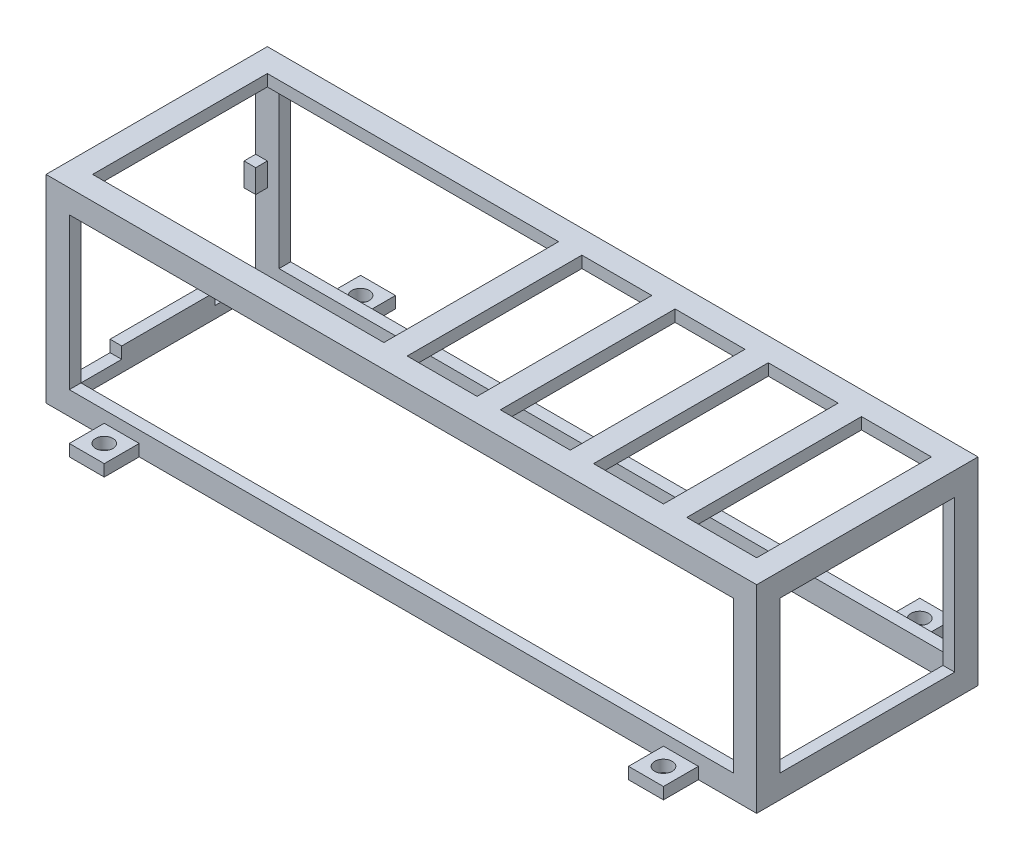
from build123d import *

# Parameters (mm, degrees)
SKETCH1_W           = 122
SKETCH1_H           = 38
SKETCH1_W_2         = 118
SKETCH1_H_2         = 34
BOSS_EXTRUDE1_DEPTH = 34
SKETCH2_W           = 34
SKETCH2_H           = 2
BOSS_EXTRUDE2_DEPTH = 120
CUT_EXTRUDE2_DEPTH  = 2
SKETCH4_W           = 114
SKETCH4_H           = 26
CUT_EXTRUDE4_DEPTH  = 2
SKETCH6_W           = 114
SKETCH6_H           = 26
CUT_EXTRUDE5_DEPTH  = 2
SKETCH7_W           = 30
SKETCH7_H           = 26
CUT_EXTRUDE6_DEPTH  = 2
SKETCH8_W           = 12
SKETCH8_H           = 30
CUT_EXTRUDE7_DEPTH  = 2
LPATTERN1_COUNT     = 4
LPATTERN1_PITCH     = 16
SKETCH9_W           = 50
SKETCH9_H           = 30
CUT_EXTRUDE8_DEPTH  = 2
SKETCH10_W          = 6
SKETCH10_H          = 2
BOSS_EXTRUDE5_DEPTH = 6
SKETCH11_W          = 6
SKETCH11_H          = 2
BOSS_EXTRUDE6_DEPTH = 6
SKETCH12_W          = 6
SKETCH12_H          = 2
BOSS_EXTRUDE7_DEPTH = 6
SKETCH13_W          = 6
SKETCH13_H          = 2
BOSS_EXTRUDE8_DEPTH = 6
SKETCH14_R          = 1.5
CUT_EXTRUDE9_DEPTH  = 2


with BuildPart() as part:
    # Sketch1 → Boss-Extrude1 (new body)
    with BuildSketch(Plane(origin=(0, 0, 0), x_dir=(1, 0, 0), z_dir=(0, 1, 0))):
        with Locations((61, 19)):
            Rectangle(SKETCH1_W, SKETCH1_H)
        with Locations((61, 19)):
            Rectangle(SKETCH1_W_2, SKETCH1_H_2, mode=Mode.SUBTRACT)
    extrude(amount=BOSS_EXTRUDE1_DEPTH)

    # Sketch2 → Boss-Extrude2 (add)
    with BuildSketch(Plane.ZY):
        with Locations((-19, 33)):
            Rectangle(SKETCH2_W, SKETCH2_H)
    extrude(amount=-BOSS_EXTRUDE2_DEPTH)

    # Sketch3 → Cut-Extrude2 (cut)
    with BuildSketch(Plane.ZY):
        Polygon((-8, 2), (-2, 2), (-2, 15), (-4, 15), (-4, 19), (-2, 19), (-2, 32), (-11, 32), (-11, 30), (-27, 30), (-27, 32), (-36, 32), (-36, 19), (-34, 19), (-34, 15), (-36, 15), (-36, 2), (-30, 2), (-27, 2), (-27, 4), (-11, 4), (-11, 2), align=None)
    extrude(amount=-CUT_EXTRUDE2_DEPTH, mode=Mode.SUBTRACT)

    # Sketch4 → Cut-Extrude4 (cut)
    with BuildSketch(Plane(origin=(0, 0, -38), x_dir=(-1, 0, 0), z_dir=(0, 0, -1))):
        with Locations((-61, 17)):
            Rectangle(SKETCH4_W, SKETCH4_H)
    extrude(amount=-CUT_EXTRUDE4_DEPTH, mode=Mode.SUBTRACT)

    # Sketch6 → Cut-Extrude5 (cut)
    with BuildSketch(Plane.XY):
        with Locations((61, 17)):
            Rectangle(SKETCH6_W, SKETCH6_H)
    extrude(amount=-CUT_EXTRUDE5_DEPTH, mode=Mode.SUBTRACT)

    # Sketch7 → Cut-Extrude6 (cut)
    with BuildSketch(Plane(origin=(122, 0, 0), x_dir=(0, 0, -1), z_dir=(1, 0, 0))):
        with Locations((19, 17)):
            Rectangle(SKETCH7_W, SKETCH7_H)
    extrude(amount=-CUT_EXTRUDE6_DEPTH, mode=Mode.SUBTRACT)

    # Sketch8 → Cut-Extrude7 (cut)
    with BuildSketch(Plane(origin=(0, 34, 0), x_dir=(1, 0, 0), z_dir=(0, 1, 0))):
        with Locations((112, 19)):
            Rectangle(SKETCH8_W, SKETCH8_H)
    cut_extrude7 = extrude(amount=-CUT_EXTRUDE7_DEPTH, mode=Mode.SUBTRACT)

    # LPattern1: Cut-Extrude7 ×4
    with Locations(*[(-i * LPATTERN1_PITCH, 0, 0) for i in range(1, LPATTERN1_COUNT)]):
        add(cut_extrude7, mode=Mode.SUBTRACT)

    # Sketch9 → Cut-Extrude8 (cut)
    with BuildSketch(Plane(origin=(0, 34, 0), x_dir=(1, 0, 0), z_dir=(0, 1, 0))):
        with Locations((29, 19)):
            Rectangle(SKETCH9_W, SKETCH9_H)
    extrude(amount=-CUT_EXTRUDE8_DEPTH, mode=Mode.SUBTRACT)

    # Sketch10 → Boss-Extrude5 (add)
    with BuildSketch(Plane(origin=(0, 0, -38), x_dir=(-1, 0, 0), z_dir=(0, 0, -1))):
        with Locations((-13, 1)):
            Rectangle(SKETCH10_W, SKETCH10_H)
    extrude(amount=BOSS_EXTRUDE5_DEPTH)

    # Sketch11 → Boss-Extrude6 (add)
    with BuildSketch(Plane(origin=(0, 0, -38), x_dir=(-1, 0, 0), z_dir=(0, 0, -1))):
        with Locations((-109, 1)):
            Rectangle(SKETCH11_W, SKETCH11_H)
    extrude(amount=BOSS_EXTRUDE6_DEPTH)

    # Sketch12 → Boss-Extrude7 (add)
    with BuildSketch(Plane.XY):
        with Locations((13, 1)):
            Rectangle(SKETCH12_W, SKETCH12_H)
    extrude(amount=BOSS_EXTRUDE7_DEPTH)

    # Sketch13 → Boss-Extrude8 (add)
    with BuildSketch(Plane.XY):
        with Locations((109, 1)):
            Rectangle(SKETCH13_W, SKETCH13_H)
    extrude(amount=BOSS_EXTRUDE8_DEPTH)

    # Sketch14 → Cut-Extrude9 (cut)
    with BuildSketch(Plane.XZ):
        with Locations(Location((109, -41, 0), (0, 0, 270))):
            Circle(SKETCH14_R)
        with Locations(Location((109, 3, 0), (0, 0, 90))):
            Circle(SKETCH14_R)
        with Locations(Location((13, 3, 0), (0, 0, 270))):
            Circle(SKETCH14_R)
        with Locations(Location((13, -41, 0), (0, 0, 90))):
            Circle(SKETCH14_R)
    extrude(amount=-CUT_EXTRUDE9_DEPTH, mode=Mode.SUBTRACT)


solid = part.part
